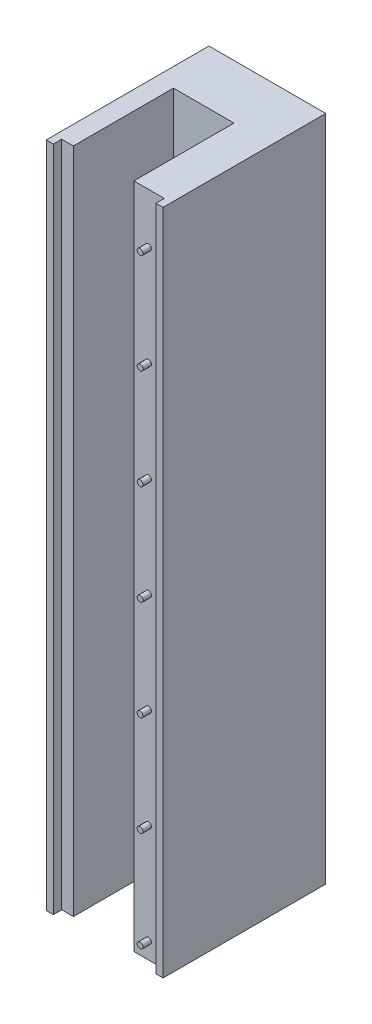
from build123d import *

# Parameters (mm, degrees)
PROFILE_EXTRUDE_DEPTH                = 80
SPROCKET_SKETCH_R                    = 0.35
SPROCKET_EXTRUDE_DEPTH               = 1
SPROCKET_PATTERN_COUNT               = 7
SPROCKET_PATTERN_PITCH               = 12
MAGNET_START                         = -6.5
MAGNET_CUT_DEPTH                     = 5
MAGNET_CHAMFER_SIZE                  = 0.75
MAGNET_CHAMFER_OF_MAGNET_MIRROR_SIZE = 0.75


with BuildPart() as part:
    # Profile Sketch → Profile Extrude (new body)
    with BuildSketch(Plane(origin=(0.045617437, 0, -0.024209872), x_dir=(-1, 0, 0), z_dir=(0, 1, 0))):
        Polygon((3.545617437, -11.975790128), (3.545617437, 0.024209872), (-0.104382563, 0.024209872), (-0.104382563, 1.024209872), (-0.954382563, 1.024209872), (-0.954382563, -18.475790128), (13.045617437, -18.475790128), (13.045617437, 1.024209872), (12.195617437, 1.024209872), (12.195617437, 0.024209872), (10.795617437, 0.024209872), (10.795617437, -11.975790128), align=None)
    extrude(amount=PROFILE_EXTRUDE_DEPTH)

    # Sprocket Sketch → Sprocket Extrude (add)
    with BuildSketch(Plane.XY):
        with Locations(Location((-1.75, 2, 0), (0, 0, 180))):
            Circle(SPROCKET_SKETCH_R)
    sprocket_extrude = extrude(amount=SPROCKET_EXTRUDE_DEPTH)

    # Sprocket Pattern: Sprocket Extrude ×7
    with Locations(*[(0, i * SPROCKET_PATTERN_PITCH, 0) for i in range(1, SPROCKET_PATTERN_COUNT)]):
        add(sprocket_extrude)

    # Magnet Hole Sketch → Magnet Cut (cut)
    with BuildSketch(Plane.XY.offset(-12).offset(MAGNET_START)):
        with BuildLine():
            ThreePointArc((-5.276039281, 12.971757773), (-6.369559557, 12.644203044), (-7.125, 13.5))
            ThreePointArc((-7.125, 13.5), (-8.753920776, 14.461963369), (-9.379949311, 12.676789795))
            ThreePointArc((-9.379949311, 12.676789795), (-9.4063426, 11.535570233), (-10.453697807, 11.08155948))
            ThreePointArc((-10.453697807, 11.08155948), (-11.87194354, 9.829626791), (-10.367596036, 8.682589301))
            ThreePointArc((-10.367596036, 8.682589301), (-9.29038771, 8.304831552), (-9.182248383, 7.16844052))
            ThreePointArc((-9.182248383, 7.16844052), (-8.429851675, 5.432740197), (-6.874085251, 6.509005616))
            ThreePointArc((-6.874085251, 6.509005616), (-6.181940604, 7.41675805), (-5.067751617, 7.16844052))
            ThreePointArc((-5.067751617, 7.16844052), (-3.184499145, 7.347651415), (-3.727330121, 9.159857515))
            ThreePointArc((-3.727330121, 9.159857515), (-4.37676953, 10.098637121), (-3.796302193, 11.08155948))
            ThreePointArc((-3.796302193, 11.08155948), (-3.384784865, 12.928018228), (-5.276039281, 12.971757773))
        make_face()
    magnet_cut = extrude(amount=MAGNET_CUT_DEPTH, mode=Mode.SUBTRACT)

    # Magnet Chamfer
    magnet_chamfer_edges = [part.edges().sort_by_distance(p)[0] for p in [
        (-3.384784865, 12.928018228, -18.5),
        (-8.753920776, 14.461963369, -18.5),
        (-11.87194354, 9.829626791, -18.5),
        (-8.429851675, 5.432740197, -18.5),
        (-3.184499145, 7.347651415, -18.5),
        (-4.37676953, 10.098637121, -18.5),
        (-6.181940604, 7.41675805, -18.5),
        (-9.29038771, 8.304831552, -18.5),
        (-9.4063426, 11.535570233, -18.5),
        (-6.369559557, 12.644203044, -18.5),
    ]]
    chamfer(magnet_chamfer_edges, length=MAGNET_CHAMFER_SIZE)

    # Magnet Mirror: Magnet Cut across plane
    add(magnet_cut.mirror(Plane(origin=(0, 40, 0), x_dir=(0, 0, 1), z_dir=(0, -1, 0))), mode=Mode.SUBTRACT)

    # Magnet Chamfer of Magnet Mirror
    magnet_chamfer_of_magnet_mirror_edges = [part.edges().sort_by_distance(p)[0] for p in [
        (-3.384784865, 67.071981772, -18.5),
        (-8.753920776, 65.538036631, -18.5),
        (-11.87194354, 70.170373209, -18.5),
        (-8.429851675, 74.567259803, -18.5),
        (-3.184499145, 72.652348585, -18.5),
        (-4.37676953, 69.901362879, -18.5),
        (-6.181940604, 72.58324195, -18.5),
        (-9.29038771, 71.695168448, -18.5),
        (-9.4063426, 68.464429767, -18.5),
        (-6.369559557, 67.355796956, -18.5),
    ]]
    chamfer(magnet_chamfer_of_magnet_mirror_edges, length=MAGNET_CHAMFER_OF_MAGNET_MIRROR_SIZE)


solid = part.part
